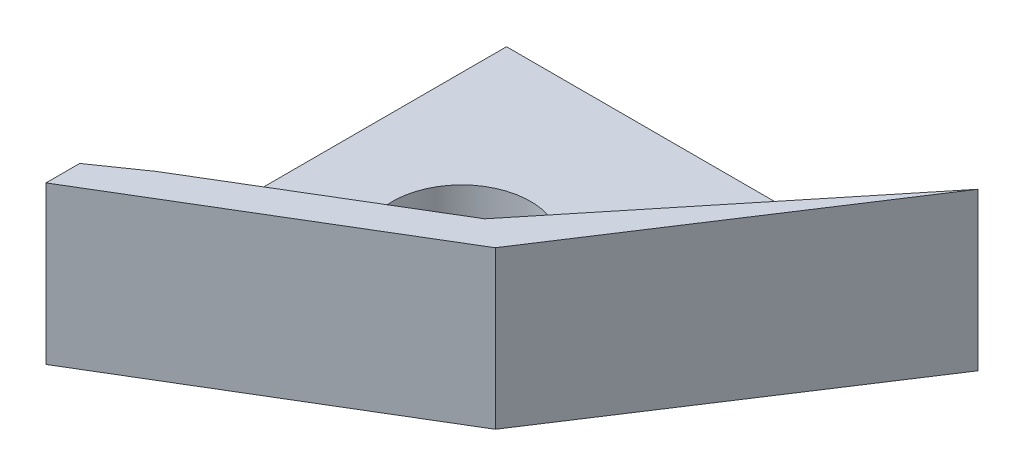
from build123d import *

# Parameters (mm, degrees)
SKETCH1_R           = 3.075
BOSS_EXTRUDE1_DEPTH = 2
BOSS_EXTRUDE2_DEPTH = 7


with BuildPart() as part:
    # Sketch1 → Boss-Extrude1 (new body)
    with BuildSketch(Plane(origin=(0, 0, 0), x_dir=(1, 0, 0), z_dir=(0, 1, 0))):
        Polygon((69.882295615, -141.15690287), (82.382295615, -133.65690287), (90.871460172, -120.65690287), (69.882295615, -120.65690287), align=None)
        with Locations(Location((76.382295615, -129.15690287, 0), (0, 0, 270))):
            Circle(SKETCH1_R, mode=Mode.SUBTRACT)
    extrude(amount=BOSS_EXTRUDE1_DEPTH)

    # Sketch2 → Boss-Extrude2 (add)
    with BuildSketch(Plane(origin=(0, 0, 0), x_dir=(-1, 0, 0), z_dir=(0, -1, 0))):
        Polygon((-69.882295615, -141.15690287), (-82.382295615, -133.65690287), (-90.871460172, -120.65690287), (-81.03443504, -132.776732853), (-71.882295615, -138.268016507), (-69.882295615, -139.65690287), align=None)
    extrude(amount=-BOSS_EXTRUDE2_DEPTH)


solid = part.part
